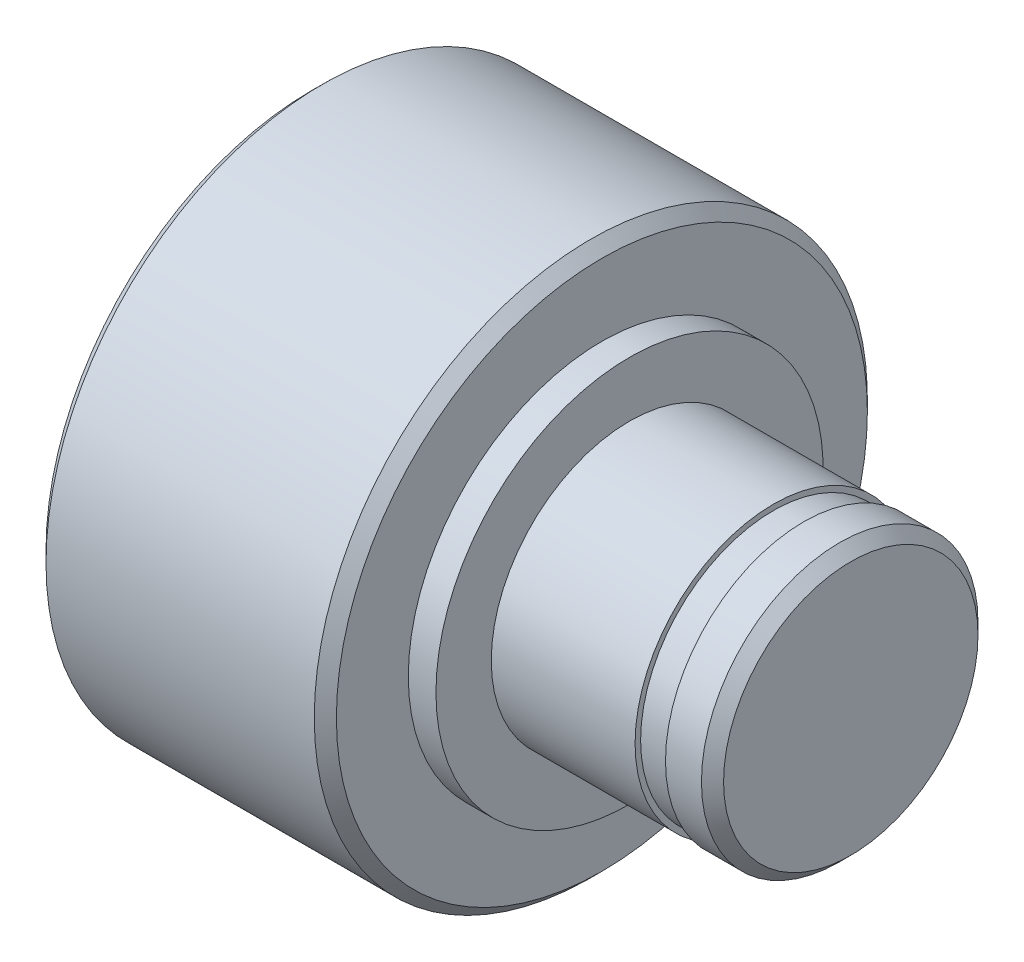
from build123d import *

# Parameters (mm, degrees)
CHAMFER1_SIZE = 0.4
SKETCH2_W     = 1.1
SKETCH2_H     = 0.2


with BuildPart() as part:
    # Sketch1 → Revolve1 (revolve)
    with BuildSketch(Plane(origin=(0, 0, 0), x_dir=(1, 0, 0), z_dir=(0, 1, 0)), mode=Mode.PRIVATE) as revolve1_sk:
        Polygon((0, 0), (0, 10), (10.5, 10), (10.5, 7), (11.5, 7), (11.5, 5), (19.5, 5), (19.5, 0), align=None)
    revolve(revolve1_sk.sketch.rotate(Axis((0, 0, 0), (1, 0, 0)), 180), axis=Axis((0, 0, 0), (1, 0, 0)))

    # Chamfer1
    chamfer1_edges = [part.edges().sort_by_distance(p)[0] for p in [
        (19.5, 0, -5),
        (10.5, 0, -10),
        (0, 0, -10),
    ]]
    chamfer(chamfer1_edges, length=CHAMFER1_SIZE)

    # Sketch2 → Cut-Revolve1 (revolve, cut)
    with BuildSketch(Plane(origin=(0, 0, 0), x_dir=(1, 0, 0), z_dir=(0, 1, 0)), mode=Mode.PRIVATE) as cut_revolve1_sk:
        with Locations((17.25, 4.9)):
            Rectangle(SKETCH2_W, SKETCH2_H)
    revolve(cut_revolve1_sk.sketch.rotate(Axis((11.5, 0, 0), (1, 0, 0)), 180), axis=Axis((11.5, 0, 0), (1, 0, 0)), mode=Mode.SUBTRACT)


solid = part.part
